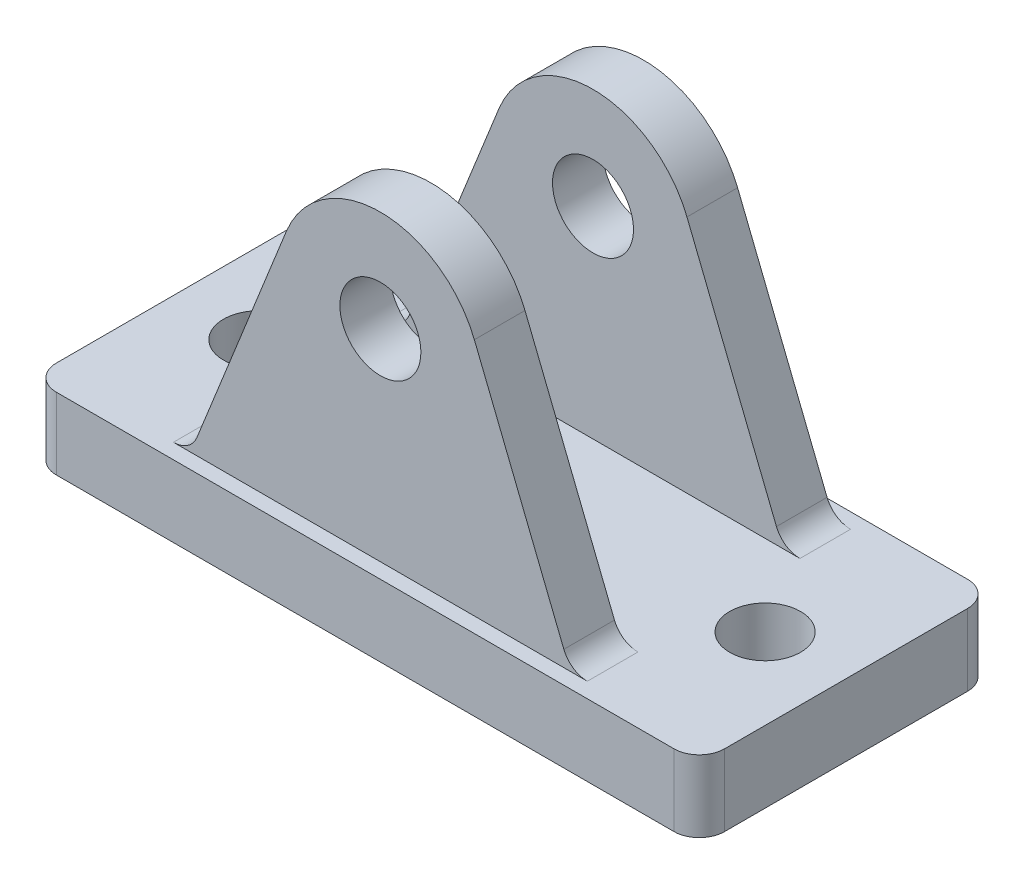
from build123d import *

# Parameters (mm, degrees)
SKETCH1_W           = 132
SKETCH1_H           = 58
BOSS_EXTRUDE1_DEPTH = 14.167595312
SKETCH2_R           = 7
CUT_EXTRUDE1_DEPTH  = 74.469182362
BOSS_EXTRUDE2_START = 16
BOSS_EXTRUDE2_DEPTH = 10
CUT_EXTRUDE2_REACH  = 115.389
SKETCH4_R           = 8
BOSS_EXTRUDE3_START = -26
BOSS_EXTRUDE3_DEPTH = 10
CUT_EXTRUDE3_REACH  = 115.389
SKETCH5_R           = 8
FILLET1_R           = 5


with BuildPart() as part:
    # Sketch1 → Boss-Extrude1 (new body)
    with BuildSketch(Plane(origin=(0, 0, 0), x_dir=(1, 0, 0), z_dir=(0, 1, 0))):
        Rectangle(SKETCH1_W, SKETCH1_H)
    extrude(amount=BOSS_EXTRUDE1_DEPTH)

    # Sketch2 → Cut-Extrude1 (cut, through all)
    with BuildSketch(Plane(origin=(0, 14.167595312, 0), x_dir=(1, 0, 0), z_dir=(0, 1, 0))):
        with Locations((-50, 0)):
            Circle(SKETCH2_R)
        with Locations((50, 0)):
            Circle(SKETCH2_R)
    extrude(amount=-CUT_EXTRUDE1_DEPTH, mode=Mode.SUBTRACT)

    # Sketch3 → Boss-Extrude2 (add)
    with BuildSketch(Plane.XY.offset(BOSS_EXTRUDE2_START)):
        with BuildLine():
            Line((37.5, 14.167595312), (-37.5, 14.167595312))
            Line((-37.5, 14.167595312), (-18.565958618, 61.436745296))
            ThreePointArc((-18.565958618, 61.436745296), (0, 74), (18.565958618, 61.436745296))
            Line((18.565958618, 61.436745296), (37.5, 14.167595312))
        make_face()
    extrude(amount=BOSS_EXTRUDE2_DEPTH)

    # Sketch4 → Cut-Extrude2 (cut, up to next)
    with BuildSketch(Plane.XY.offset(26), mode=Mode.PRIVATE) as cut_extrude2_sk1:
        with Locations((0, 54)):
            Circle(SKETCH4_R)
    cut_extrude2_tool1 = extrude(cut_extrude2_sk1.sketch, amount=-CUT_EXTRUDE2_REACH, mode=Mode.PRIVATE) & part.part
    add(cut_extrude2_tool1.solids().sort_by_distance((0, 54, 26))[0], mode=Mode.SUBTRACT)

    # Sketch3<2> → Boss-Extrude3 (add)
    with BuildSketch(Plane.XY.offset(BOSS_EXTRUDE3_START)):
        with BuildLine():
            Line((37.5, 14.167595312), (-37.5, 14.167595312))
            Line((-37.5, 14.167595312), (-18.565958618, 61.436745296))
            ThreePointArc((-18.565958618, 61.436745296), (0, 74), (18.565958618, 61.436745296))
            Line((18.565958618, 61.436745296), (37.5, 14.167595312))
        make_face()
    extrude(amount=BOSS_EXTRUDE3_DEPTH)

    # Sketch5 → Cut-Extrude3 (cut, up to next)
    with BuildSketch(Plane(origin=(0, 0, -26), x_dir=(-1, 0, 0), z_dir=(0, 0, -1)), mode=Mode.PRIVATE) as cut_extrude3_sk1:
        with Locations((0, 54)):
            Circle(SKETCH5_R)
    cut_extrude3_tool1 = extrude(cut_extrude3_sk1.sketch, amount=-CUT_EXTRUDE3_REACH, mode=Mode.PRIVATE) & part.part
    add(cut_extrude3_tool1.solids().sort_by_distance((0, 54, -26))[0], mode=Mode.SUBTRACT)

    # Fillet1
    fillet1_edges = [part.edges().sort_by_distance(p)[0] for p in [
        (-37.5, 14.167595312, -21),
        (37.5, 14.167595312, -21),
        (37.5, 14.167595312, 21),
        (-37.5, 14.167595312, 21),
        (-66, 7.083797656, -29),
        (66, 7.083797656, -29),
        (-66, 7.083797656, 29),
        (66, 7.083797656, 29),
    ]]
    fillet(fillet1_edges, radius=FILLET1_R)


solid = part.part
